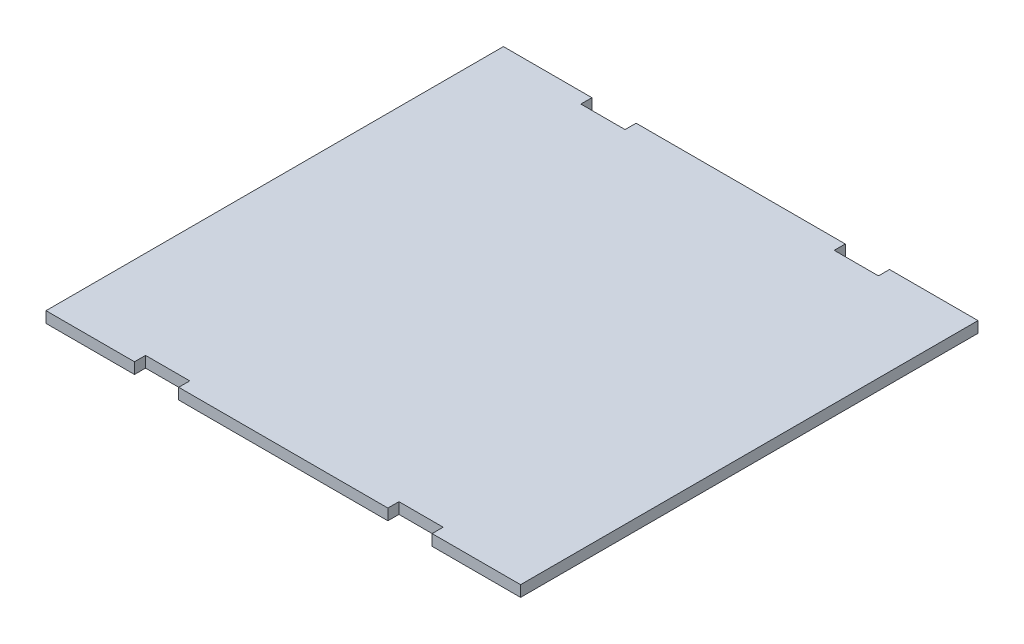
from build123d import *

# Parameters (mm, degrees)
BOSS_EXTRUDE1_DEPTH = 3.175


with BuildPart() as part:
    # Sketch1 → Boss-Extrude1 (new body)
    with BuildSketch(Plane(origin=(0, 0, 0), x_dir=(1, 0, 0), z_dir=(0, 1, 0))):
        Polygon((-68.1228, 65.659), (-42.7228, 65.659), (-42.7228, 62.484), (-30.0228, 62.484), (-30.0228, 65.659), (30.0228, 65.659), (30.0228, 62.484), (42.7228, 62.484), (42.7228, 65.659), (68.1228, 65.659), (68.1228, -65.659), (42.7228, -65.659), (42.7228, -62.484), (30.0228, -62.484), (30.0228, -65.659), (-30.0228, -65.659), (-30.0228, -62.484), (-42.7228, -62.484), (-42.7228, -65.659), (-68.1228, -65.659), align=None)
    extrude(amount=BOSS_EXTRUDE1_DEPTH)


solid = part.part
